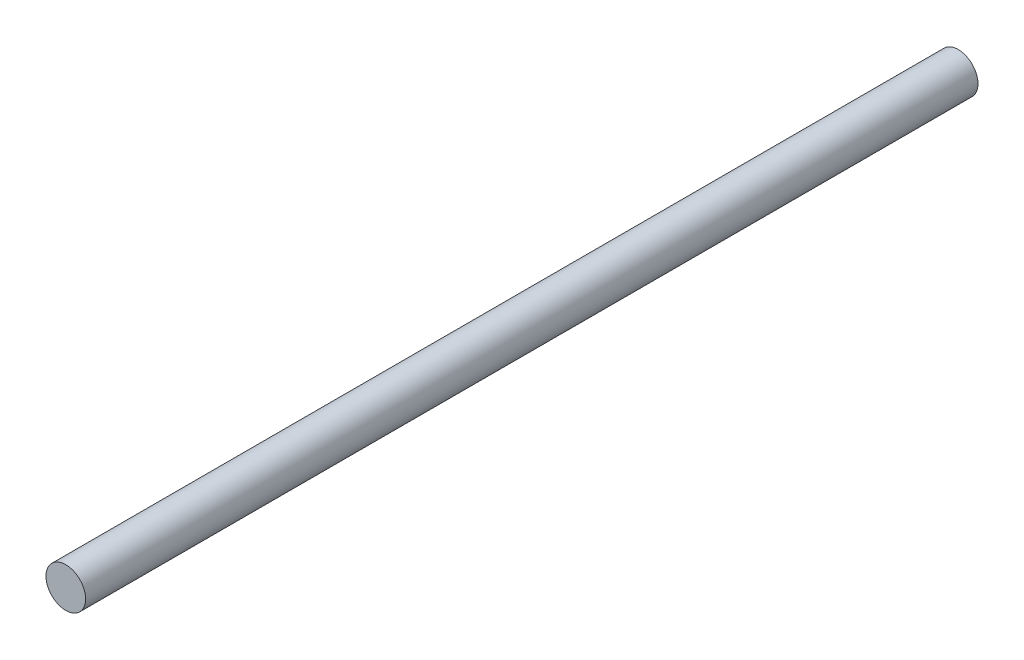
from build123d import *

# Parameters (mm, degrees)
CROQUIS1_R              = 10
SALIENTE_EXTRUIR1_DEPTH = 225


with BuildPart() as part:
    # Croquis1 → Saliente-Extruir1 (new, symmetric)
    with BuildSketch(Plane.XY):
        Circle(CROQUIS1_R)
    extrude(amount=SALIENTE_EXTRUIR1_DEPTH, both=True)


solid = part.part
